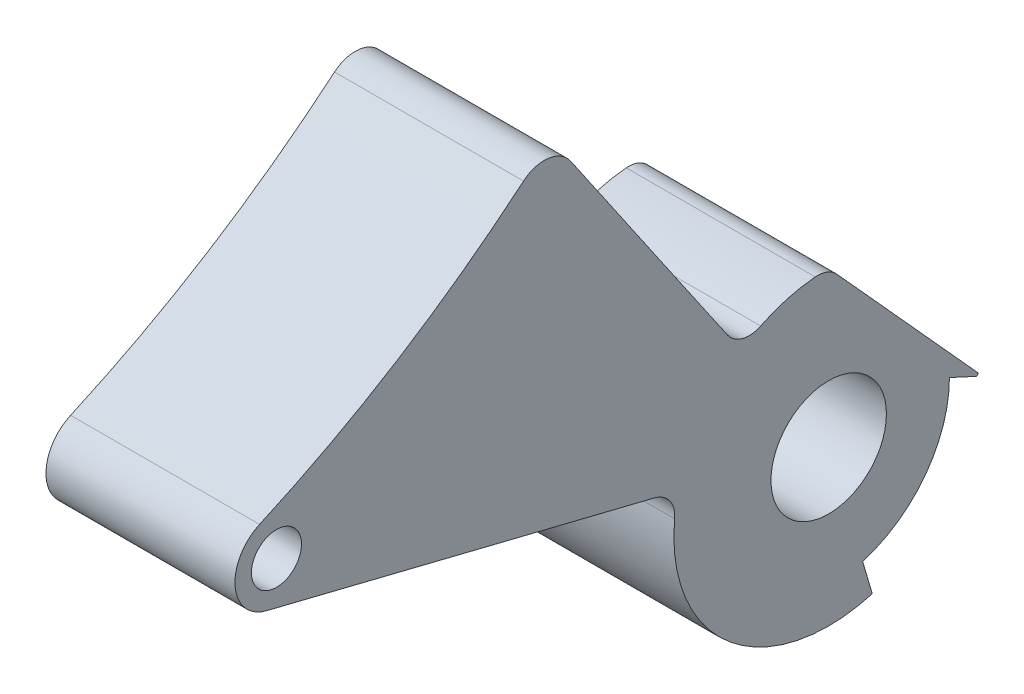
from build123d import *

# Parameters (mm, degrees)
SKETCH1_R           = 2.794
SKETCH1_R_2         = 1.212486465
BOSS_EXTRUDE1_DEPTH = 9.144
FILLET1_R           = 0.0762
FILLET2_R           = 1.27
FILLET3_R           = 1.27
FILLET4_R           = 1.27


with BuildPart() as part:
    # Sketch1 → Boss-Extrude1 (new body)
    with BuildSketch(Plane(origin=(0, 0, 0), x_dir=(0, 0, -1), z_dir=(1, 0, 0))):
        with BuildLine():
            Line((7.455728261, -0.746434927), (0, 7.493))
            ThreePointArc((0, 7.493), (-2.216071025, 7.157798419), (-4.23386886, 6.182184362))
            Line((-4.23386886, 6.182184362), (-12.48371449, 18.228392766))
            ThreePointArc((-12.48371449, 18.228392766), (-13.557344424, 18.890595677), (-14.768732641, 18.538839342))
            ThreePointArc((-14.768732641, 18.538839342), (-20.873202748, 14.088773121), (-27.541235985, 10.538424208))
            ThreePointArc((-27.541235985, 10.538424208), (-28.725821969, 8.525909619), (-27.207679666, 6.751451146))
            Line((-27.207679666, 6.751451146), (-7.27244078, 1.804620212))
            ThreePointArc((-7.27244078, 1.804620212), (-5.186520816, -5.407869342), (2.106798928, -7.190719524))
            Line((2.106798928, -7.190719524), (1.642588995, -5.606323697))
            ThreePointArc((1.642588995, -5.606323697), (4.675733574, -3.50235343), (5.842, 0))
            Line((5.842, 0), (7.455728261, -0.746434927))
        make_face()
        Circle(SKETCH1_R, mode=Mode.SUBTRACT)
        with Locations((-26.723594694, 8.702265656)):
            Circle(SKETCH1_R_2, mode=Mode.SUBTRACT)
    extrude(amount=BOSS_EXTRUDE1_DEPTH)

    # Fillet1
    fillet1_edges = [part.edges().sort_by_distance(p)[0] for p in [
        (4.572, -0.746434927, -7.455728261),
    ]]
    fillet(fillet1_edges, radius=FILLET1_R)

    # Fillet2
    fillet2_edges = [part.edges().sort_by_distance(p)[0] for p in [
        (4.572, 6.182184362, 4.23386886),
    ]]
    fillet(fillet2_edges, radius=FILLET2_R)

    # Fillet3
    fillet3_edges = [part.edges().sort_by_distance(p)[0] for p in [
        (4.572, 7.493, 0),
    ]]
    fillet(fillet3_edges, radius=FILLET3_R)

    # Fillet4
    fillet4_edges = [part.edges().sort_by_distance(p)[0] for p in [
        (4.572, 1.804620212, 7.27244078),
    ]]
    fillet(fillet4_edges, radius=FILLET4_R)


solid = part.part
